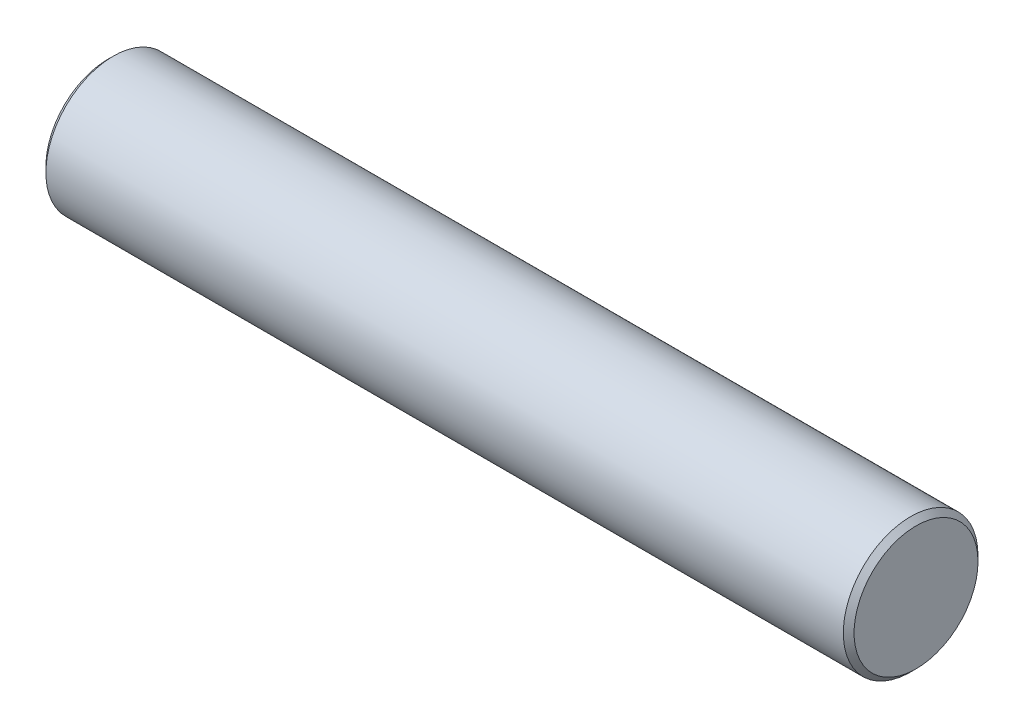
from build123d import *

# Parameters (mm, degrees)
SKETCH2_W     = 30
SKETCH2_H     = 2.5
CHAMFER2_SIZE = 0.2


with BuildPart() as part:
    # Sketch2 → Revolve1 (revolve)
    with BuildSketch(Plane.XY, mode=Mode.PRIVATE) as revolve1_sk:
        with Locations((-15, 1.25)):
            Rectangle(SKETCH2_W, SKETCH2_H)
    revolve(revolve1_sk.sketch.rotate(Axis((0, 0, 0), (-1, 0, 0)), 90), axis=Axis((0, 0, 0), (-1, 0, 0)))

    # Chamfer2
    chamfer2_edges = [part.edges().sort_by_distance(p)[0] for p in [
        (-30, 0, 2.5),
        (0, 0, 2.5),
    ]]
    chamfer(chamfer2_edges, length=CHAMFER2_SIZE)


solid = part.part
